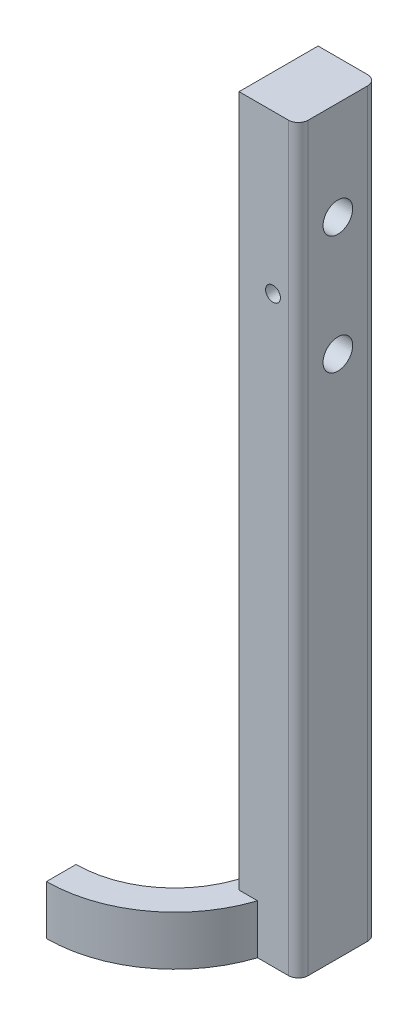
from build123d import *

# Parameters (mm, degrees)
BOSS_EXTRUDE1_DEPTH = 5
SKETCH2_W           = 6
SKETCH2_H           = 8
BOSS_EXTRUDE2_DEPTH = 75
FILLET2_R           = 1
SKETCH3_R           = 1.5
CUT_EXTRUDE1_DEPTH  = 77.839117642
BOSS_EXTRUDE3_DEPTH = 0.5
SKETCH6_R           = 0.75
CUT_EXTRUDE3_DEPTH  = 79.652717711


with BuildPart() as part:
    # Sketch1 → Boss-Extrude1 (new body)
    with BuildSketch(Plane(origin=(0, 0, 0), x_dir=(1, 0, 0), z_dir=(0, 1, 0))):
        with BuildLine():
            Line((0, 13), (0, 10))
            ThreePointArc((0, 10), (10, 0), (0, -10))
            Line((0, -10), (0, -13))
            ThreePointArc((0, -13), (13, 0), (0, 13))
        make_face()
    extrude(amount=BOSS_EXTRUDE1_DEPTH)

    # Sketch2 → Boss-Extrude2 (add)
    with BuildSketch(Plane(origin=(0, 0, 0), x_dir=(1, 0, 0), z_dir=(0, 1, 0))):
        with Locations((13.5, 0)):
            Rectangle(SKETCH2_W, SKETCH2_H)
    extrude(amount=BOSS_EXTRUDE2_DEPTH)

    # Fillet2
    fillet2_edges = [part.edges().sort_by_distance(p)[0] for p in [
        (16.5, 37.5, -4),
        (16.5, 37.5, 4),
    ]]
    fillet(fillet2_edges, radius=FILLET2_R)

    # Sketch3 → Cut-Extrude1 (cut, through all)
    with BuildSketch(Plane.ZY.offset(-10.5)):
        with Locations((0, 65)):
            Circle(SKETCH3_R)
        with Locations((0, 53)):
            Circle(SKETCH3_R)
    extrude(amount=-CUT_EXTRUDE1_DEPTH, mode=Mode.SUBTRACT)



with BuildPart() as body_2:
    # Sketch4 → Boss-Extrude3 (new, symmetric)
    with BuildSketch(Plane(origin=(0, 2.5, 0), x_dir=(1, 0, 0), z_dir=(0, 1, 0))):
        with BuildLine():
            Line((0, 9), (0, 8.5))
            ThreePointArc((0, 8.5), (8.5, 0), (0, -8.5))
            Line((0, -8.5), (0, -9))
            ThreePointArc((0, -9), (9, 0), (0, 9))
        make_face()
    extrude(amount=BOSS_EXTRUDE3_DEPTH, both=True)


with BuildPart() as part_1:
    add(part.part)

    add(body_2.part)  # loft1 joins it to this body
    # loft from a face of the part (loft1)
    loft([part_1.faces().sort_by_distance((10, 2.5, 0))[0], part_1.faces().sort_by_distance((8.5, 2.5, 0))[0]])

    # Sketch6 → Cut-Extrude3 (cut, through all)
    with BuildSketch(Plane.XY.offset(4)):
        with Locations((13.934658438, 59)):
            Circle(SKETCH6_R)
    extrude(amount=-CUT_EXTRUDE3_DEPTH, mode=Mode.SUBTRACT)


solid = part_1.part
